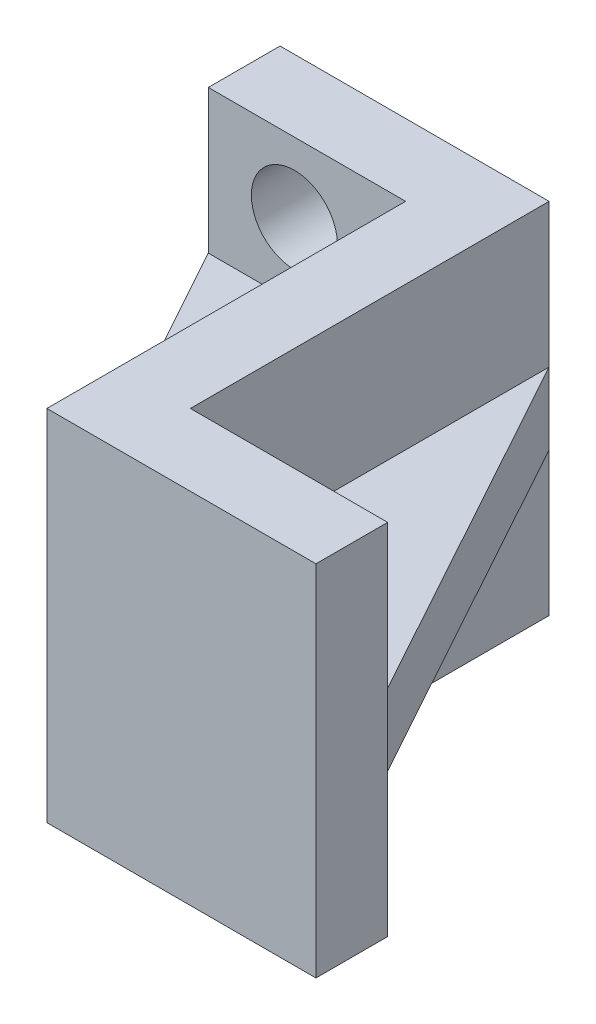
from build123d import *

# Parameters (mm, degrees)
SKETCH1_W               = 200
SKETCH1_H               = 240
BOSS_EXTRUDE1_DEPTH     = 20
SKETCH2_W               = 200
SKETCH2_H               = 40
BOSS_EXTRUDE2_DEPTH     = 110
SKETCH3_W               = 200
SKETCH3_H               = 40
BOSS_EXTRUDE3_DEPTH     = 110
RIB1_REACH              = 205.224
SKETCH4_WALL_W          = 636.702272868
SKETCH4_WALL_H          = 40
RIB2_REACH              = 205.224
SKETCH6_WALL_W          = 636.702272868
SKETCH6_WALL_H          = 40
CUT_EXTRUDE1_DEPTH      = 259.650343128
CUT_EXTRUDE1_DEPTH_BACK = 259.650343128
SKETCH7_R               = 24


with BuildPart() as part:
    # Sketch1 → Boss-Extrude1 (new, symmetric)
    with BuildSketch(Plane.YZ):
        Rectangle(SKETCH1_W, SKETCH1_H)
    extrude(amount=BOSS_EXTRUDE1_DEPTH, both=True)

    # Sketch2 → Boss-Extrude2 (add)
    with BuildSketch(Plane.YZ.offset(20)):
        with Locations((0, 100)):
            Rectangle(SKETCH2_W, SKETCH2_H)
    extrude(amount=BOSS_EXTRUDE2_DEPTH)

    # Sketch3 → Boss-Extrude3 (add)
    with BuildSketch(Plane(origin=(-20, 0, 0), x_dir=(0, -1, 0), z_dir=(-1, 0, 0))):
        with Locations((0, -100)):
            Rectangle(SKETCH3_W, SKETCH3_H)
    extrude(amount=BOSS_EXTRUDE3_DEPTH)

    # Sketch4 wall → Rib1 (add, up to next)
    with BuildSketch(Plane(origin=(75, 0, -20), x_dir=(-0.481918749772, 0, -0.876215908677), z_dir=(-0.876215908677, 0, 0.481918749772)), mode=Mode.PRIVATE) as rib1_sk1:
        Rectangle(SKETCH4_WALL_W, SKETCH4_WALL_H)
    rib1_tool1 = extrude(rib1_sk1.sketch, amount=RIB1_REACH, mode=Mode.PRIVATE) - part.part
    add(rib1_tool1.solids().sort_by_distance((75, 0, -20))[0])

    # Sketch6 wall → Rib2 (add, up to next)
    with BuildSketch(Plane(origin=(-75, 0, 20), x_dir=(-0.481918749772, 0, -0.876215908677), z_dir=(-0.876215908677, 0, 0.481918749772)), mode=Mode.PRIVATE) as rib2_sk1:
        Rectangle(SKETCH6_WALL_W, SKETCH6_WALL_H)
    rib2_tool1 = extrude(rib2_sk1.sketch, amount=-RIB2_REACH, mode=Mode.PRIVATE) - part.part
    add(rib2_tool1.solids().sort_by_distance((-75, 0, 20))[0])

    # Sketch7 → Cut-Extrude1 (cut, two sides: drawn at the far end of the back side and taken through both)
    with BuildSketch(Plane.XY.offset(-80).offset(-CUT_EXTRUDE1_DEPTH_BACK)):
        with Locations((-82, -60)):
            Circle(SKETCH7_R)
        with Locations(Location((-82, 60, 0), (0, 0, 180))):
            Circle(SKETCH7_R)
    extrude(amount=CUT_EXTRUDE1_DEPTH + CUT_EXTRUDE1_DEPTH_BACK, mode=Mode.SUBTRACT)


solid = part.part
